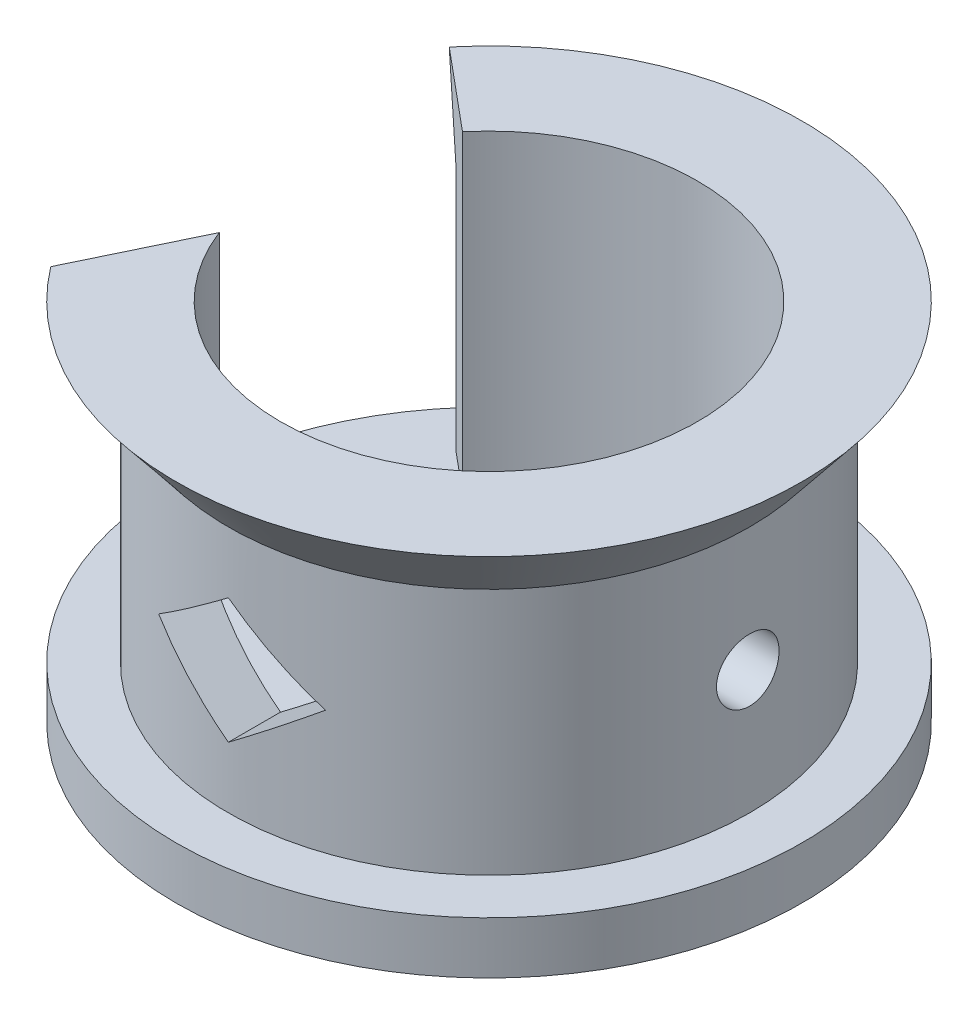
from build123d import *

# Parameters (mm, degrees)
SKETCH4_R           = 6
BOSS_EXTRUDE3_DEPTH = 1
SKETCH5_R           = 5
SKETCH5_R_2         = 4
BOSS_EXTRUDE4_DEPTH = 4.75
CUT_EXTRUDE3_START  = -3
SKETCH9_R           = 4
CUT_EXTRUDE3_DEPTH  = 3
CUT_EXTRUDE7_DEPTH  = 10
CUT_EXTRUDE8_DEPTH  = 10
CUT_EXTRUDE10_START = -6
CUT_EXTRUDE10_DEPTH = 6
SKETCH14_R          = 2.4
CUT_EXTRUDE11_DEPTH = 6


with BuildPart() as part:
    # Sketch4 → Boss-Extrude3 (new body)
    with BuildSketch(Plane(origin=(0, 0, 0), x_dir=(1, 0, 0), z_dir=(0, 1, 0))):
        with Locations(Location((0, 0, 0), (0, 0, 270))):
            Circle(SKETCH4_R)
    extrude(amount=BOSS_EXTRUDE3_DEPTH)

    # Sketch5 → Boss-Extrude4 (add)
    with BuildSketch(Plane(origin=(0, 1, 0), x_dir=(1, 0, 0), z_dir=(0, 1, 0))):
        with Locations(Location((0, 0, 0), (0, 0, 270))):
            Circle(SKETCH5_R)
        with Locations(Location((0, 0, 0), (0, 0, 270))):
            Circle(SKETCH5_R_2, mode=Mode.SUBTRACT)
    extrude(amount=BOSS_EXTRUDE4_DEPTH)

    # Sketch6 → Revolve4 (revolve)
    with BuildSketch(Plane.XY, mode=Mode.PRIVATE) as revolve4_sk:
        Polygon((0, 5.75), (5, 5.75), (6, 7), (0, 7), align=None)
    revolve(revolve4_sk.sketch.rotate(Axis((0, 5.75, 0), (0, 1, 0)), 270), axis=Axis((0, 5.75, 0), (0, 1, 0)))

    # Sketch9 → Cut-Extrude3 (cut)
    with BuildSketch(Plane(origin=(0, 7, 0), x_dir=(1, 0, 0), z_dir=(0, 1, 0)).offset(CUT_EXTRUDE3_START)):
        with Locations(Location((0, 0, 0), (0, 0, 270))):
            Circle(SKETCH9_R)
    extrude(amount=CUT_EXTRUDE3_DEPTH, mode=Mode.SUBTRACT)

    # Sketch11 → Cut-Extrude7 (cut)
    with BuildSketch(Plane.XY):
        Polygon((0, 4.575), (0, 3.375), (1.2, 3.375), (1.6, 3.375), align=None)
        Polygon((-1.2, 3.375), (0, 3.375), (0, 4.575), (-1.6, 3.375), align=None)
        Polygon((0, 2.175), (0, 3.375), (-1.2, 3.375), (-1.6, 3.375), align=None)
        Polygon((1.2, 3.375), (0, 3.375), (0, 2.175), (1.6, 3.375), align=None)
    extrude(amount=CUT_EXTRUDE7_DEPTH, mode=Mode.SUBTRACT)

    # Sketch12 → Cut-Extrude8 (cut)
    with BuildSketch(Plane(origin=(0, 0, 0), x_dir=(0, 0, -1), z_dir=(1, 0, 0))):
        with BuildLine():
            ThreePointArc((0.6, 3.375), (0.424264069, 3.799264069), (0, 3.975))
            Line((0, 3.975), (0, 2.775))
            ThreePointArc((0, 2.775), (0.424264069, 2.950735931), (0.6, 3.375))
        make_face()
        with BuildLine():
            Line((0, 2.775), (0, 3.975))
            ThreePointArc((0, 3.975), (-0.6, 3.375), (0, 2.775))
        make_face()
    extrude(amount=CUT_EXTRUDE8_DEPTH, mode=Mode.SUBTRACT)

    # Sketch13 → Cut-Extrude10 (cut)
    with BuildSketch(Plane(origin=(0, 7, 0), x_dir=(1, 0, 0), z_dir=(0, 1, 0)).offset(CUT_EXTRUDE10_START)):
        with BuildLine():
            Line((-4.779206309, -3.627559381), (-3.72991173, -1.444907777))
            ThreePointArc((-3.72991173, -1.444907777), (-3.947043415, 0.648728201), (-3.071224525, 2.562728998))
            Line((-3.071224525, 2.562728998), (-4.606836788, 3.844093497))
            ThreePointArc((-4.606836788, 3.844093497), (-5.99840399, 0.138381967), (-4.779206309, -3.627559381))
        make_face()
    extrude(amount=CUT_EXTRUDE10_DEPTH, mode=Mode.SUBTRACT)

    # Sketch14 → Cut-Extrude11 (cut)
    with BuildSketch(Plane(origin=(0, 1, 0), x_dir=(1, 0, 0), z_dir=(0, 1, 0))):
        with Locations(Location((0, 0, 0), (0, 0, 270))):
            Circle(SKETCH14_R)
    extrude(amount=-CUT_EXTRUDE11_DEPTH, mode=Mode.SUBTRACT)


solid = part.part
